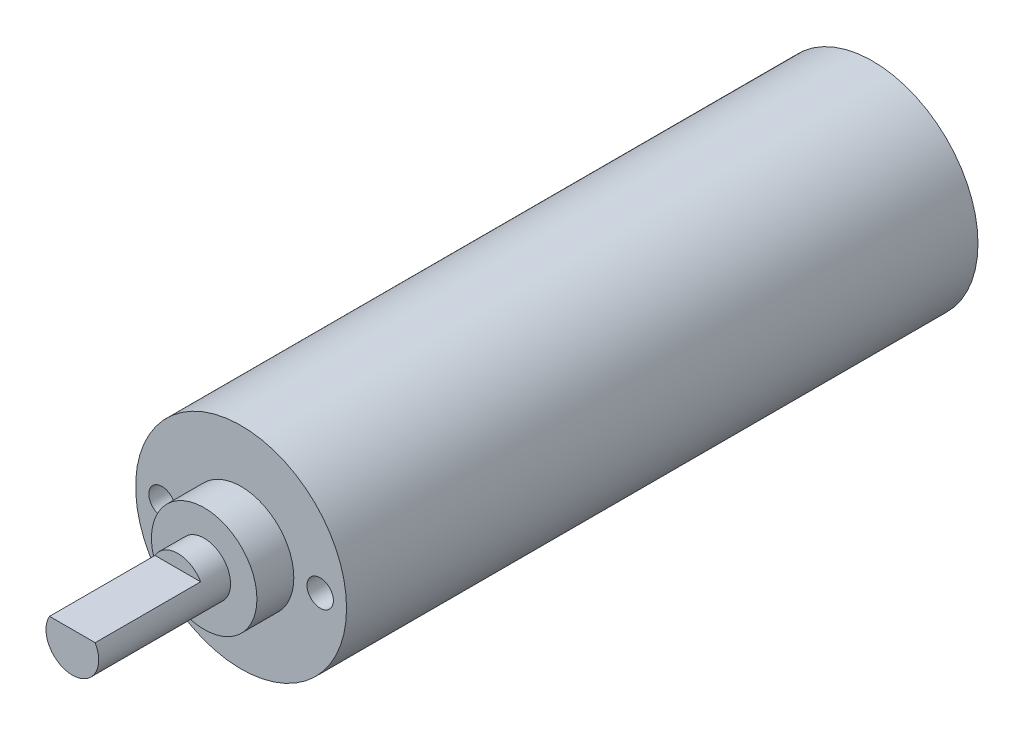
from build123d import *

# Parameters (mm, degrees)
ESQUISSE1_R             = 8
BOSS_EXTRU_1_DEPTH      = 47.9
ESQUISSE2_R             = 4
BOSS_EXTRU_2_DEPTH      = 2.8
ESQUISSE3_R             = 2
BOSS_EXTRU_3_DEPTH      = 10
ESQUISSE5_W             = 4
ESQUISSE5_H             = 8
ENL_V_MAT_EXTRU_1_DEPTH = 10
BOSS_EXTRU_4_START      = 1.5
ESQUISSE6_R             = 4
BOSS_EXTRU_4_DEPTH      = 1.5
ESQUISSE7_R             = 1
ENL_V_MAT_EXTRU_2_DEPTH = 6


with BuildPart() as part:
    # Esquisse1 → Boss.-Extru.1 (new body)
    with BuildSketch(Plane.XY):
        Circle(ESQUISSE1_R)
    extrude(amount=BOSS_EXTRU_1_DEPTH)

    # Esquisse2 → Boss.-Extru.2 (add)
    with BuildSketch(Plane.XY.offset(47.9)):
        Circle(ESQUISSE2_R)
    extrude(amount=BOSS_EXTRU_2_DEPTH)

    # Esquisse3 → Boss.-Extru.3 (add)
    with BuildSketch(Plane.XY.offset(50.7)):
        Circle(ESQUISSE3_R)
    extrude(amount=BOSS_EXTRU_3_DEPTH)

    # Esquisse5 → Enlèv. mat.-Extru.1 (cut)
    with BuildSketch(Plane(origin=(0, 1, 0), x_dir=(1, 0, 0), z_dir=(0, 1, 0))):
        with Locations((0, -56.7)):
            Rectangle(ESQUISSE5_W, ESQUISSE5_H)
    extrude(amount=ENL_V_MAT_EXTRU_1_DEPTH, mode=Mode.SUBTRACT)

    # Esquisse6 → Boss.-Extru.4 (add)
    with BuildSketch(Plane(origin=(0, 0, 0), x_dir=(-1, 0, 0), z_dir=(0, 0, -1)).offset(BOSS_EXTRU_4_START)):
        with Locations(Location((0, 0, 0), (0, 0, 180))):
            Circle(ESQUISSE6_R)
    extrude(amount=-BOSS_EXTRU_4_DEPTH)

    # Esquisse7 → Enlèv. mat.-Extru.2 (cut)
    with BuildSketch(Plane.XY.offset(47.9)):
        with Locations((6, 0)):
            Circle(ESQUISSE7_R)
        with Locations((-6, 0)):
            Circle(ESQUISSE7_R)
    extrude(amount=-ENL_V_MAT_EXTRU_2_DEPTH, mode=Mode.SUBTRACT)


solid = part.part
